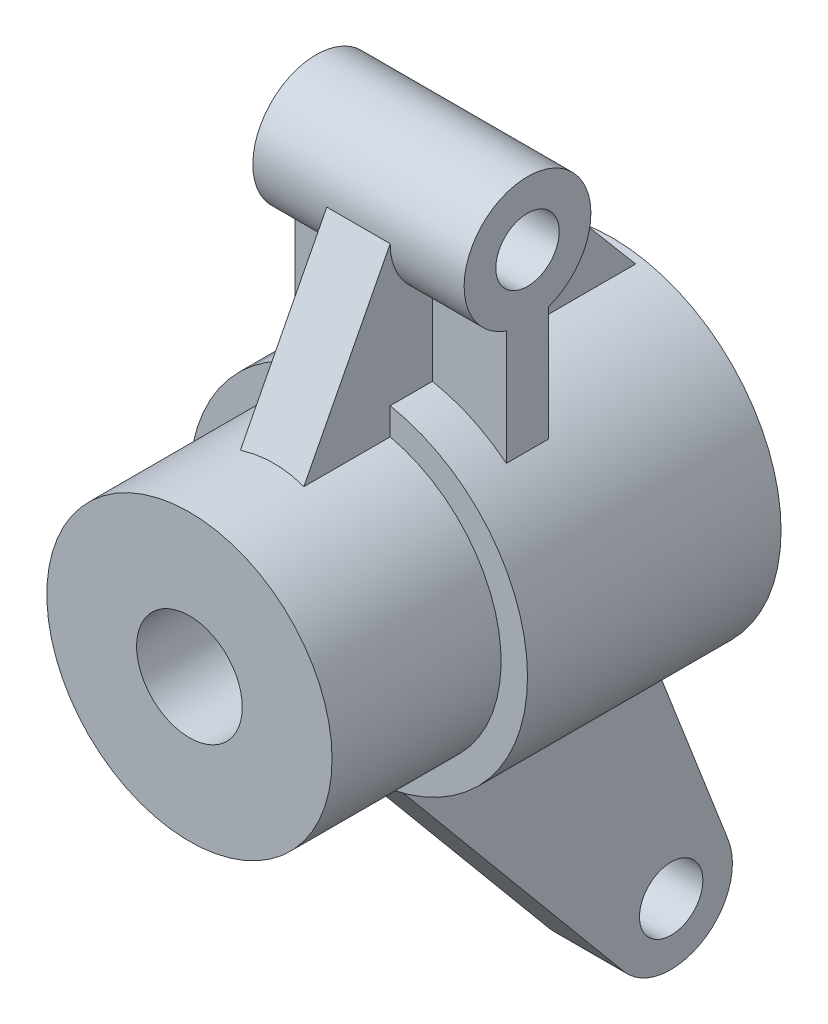
from build123d import *

# Parameters (mm, degrees)
SKETCH1_R                            = 8
BOSS_EXTRUDE1_DEPTH                  = 12
SKETCH2_R                            = 6.75
BOSS_EXTRUDE2_DEPTH                  = 8
SKETCH3_R                            = 2.5
CUT_EXTRUDE1_DEPTH                   = 23.978250586
SKETCH4_R                            = 6.25
CUT_EXTRUDE2_DEPTH                   = 10
SKETCH5_R                            = 4
CUT_EXTRUDE3_DEPTH                   = 13
BOSS_EXTRUDE3_DEPTH                  = 5
BOSS_EXTRUDE3_DEPTH_BACK             = 5
SKETCH6_R                            = 3
SKETCH6_R_2                          = 1.5
BOSS_EXTRUDE4_REACH                  = 31.056
BOSS_EXTRUDE4_END_RADIUS             = 8
SKETCH7_W                            = 10
SKETCH7_H                            = 2
BOSS_EXTRUDE4_DIRECTION_2_REACH      = 31.056
BOSS_EXTRUDE4_DIRECTION_2_END_RADIUS = 3
RIB4_REACH                           = 29.753
SKETCH10_WALL_W                      = 66.021449528
SKETCH10_WALL_H                      = 3
RIB5_REACH                           = 29.753
SKETCH11_WALL_W                      = 66.228138116
SKETCH11_WALL_H                      = 3
BOSS_EXTRUDE5_REACH                  = 48.673
BOSS_EXTRUDE5_END_RADIUS             = 8
RIB7_REACH                           = 32.936
SKETCH15_WALL_W                      = 82.361497922
SKETCH15_WALL_H                      = 3.5
FILLET2_R                            = 2.9
CUT_EXTRUDE5_REACH                   = 33.044
SKETCH19_R                           = 1.5


with BuildPart() as part:
    # Sketch1 → Boss-Extrude1 (new body)
    with BuildSketch(Plane.XY):
        Circle(SKETCH1_R)
    extrude(amount=BOSS_EXTRUDE1_DEPTH)

    # Sketch2 → Boss-Extrude2 (add)
    with BuildSketch(Plane.XY.offset(12)):
        Circle(SKETCH2_R)
    extrude(amount=BOSS_EXTRUDE2_DEPTH)

    # Sketch3 → Cut-Extrude1 (cut, through all)
    with BuildSketch(Plane.XY.offset(20)):
        Circle(SKETCH3_R)
    extrude(amount=-CUT_EXTRUDE1_DEPTH, mode=Mode.SUBTRACT)

    # Sketch4 → Cut-Extrude2 (cut)
    with BuildSketch(Plane(origin=(0, 0, 0), x_dir=(-1, 0, 0), z_dir=(0, 0, -1))):
        Circle(SKETCH4_R)
    extrude(amount=-CUT_EXTRUDE2_DEPTH, mode=Mode.SUBTRACT)

    # Sketch5 → Cut-Extrude3 (cut)
    with BuildSketch(Plane(origin=(0, 0, 0), x_dir=(-1, 0, 0), z_dir=(0, 0, -1))):
        Circle(SKETCH5_R)
    extrude(amount=-CUT_EXTRUDE3_DEPTH, mode=Mode.SUBTRACT)



with BuildPart() as body_2:
    # Sketch6 → Boss-Extrude3 (new, two sides: drawn at the far end of the back side and taken through both)
    with BuildSketch(Plane(origin=(0, 0, 0), x_dir=(0, 0, -1), z_dir=(1, 0, 0)).offset(-BOSS_EXTRUDE3_DEPTH_BACK)):
        with Locations((-9, 14.5)):
            Circle(SKETCH6_R)
        with Locations((-9, 14.5)):
            Circle(SKETCH6_R_2, mode=Mode.SUBTRACT)
    extrude(amount=BOSS_EXTRUDE3_DEPTH + BOSS_EXTRUDE3_DEPTH_BACK)


with BuildPart() as part_1:
    add(part.part)

    add(body_2.part)  # Boss-Extrude4 merges body 2
    # Boss-Extrude4: up to this cylinder (the profile starts outside it)
    boss_extrude4_end = Plane(origin=(0, 0, 9), z_dir=(0, 0, -1)) * Cylinder(BOSS_EXTRUDE4_END_RADIUS, 79.112, mode=Mode.PRIVATE)
    # Sketch7 → Boss-Extrude4 (add, up to the surface)
    with BuildSketch(Plane(origin=(0, 11.5, 0), x_dir=(-1, 0, 0), z_dir=(0, -1, 0)), mode=Mode.PRIVATE) as boss_extrude4_sk1:
        with Locations((0, -9)):
            Rectangle(SKETCH7_W, SKETCH7_H)
    boss_extrude4_tool1 = extrude(boss_extrude4_sk1.sketch, amount=BOSS_EXTRUDE4_REACH, mode=Mode.PRIVATE) - boss_extrude4_end
    add(boss_extrude4_tool1.solids().sort_by_distance((0, 11.5, 9))[0])

    # Boss-Extrude4 direction 2: up to this cylinder (the profile starts outside it)
    boss_extrude4_direction_2_end = Plane(origin=(0, 14.5, 9), z_dir=(1, 0, 0)) * Cylinder(BOSS_EXTRUDE4_DIRECTION_2_END_RADIUS, 69.112, mode=Mode.PRIVATE)
    # Sketch7 → Boss-Extrude4 direction 2 (add, up to the surface)
    with BuildSketch(Plane(origin=(0, 11.5, 0), x_dir=(-1, 0, 0), z_dir=(0, -1, 0)), mode=Mode.PRIVATE) as boss_extrude4_direction_2_sk1:
        with Locations((0, -9)):
            Rectangle(SKETCH7_W, SKETCH7_H)
    boss_extrude4_direction_2_tool1 = extrude(boss_extrude4_direction_2_sk1.sketch, amount=-BOSS_EXTRUDE4_DIRECTION_2_REACH, mode=Mode.PRIVATE) - boss_extrude4_direction_2_end
    add(boss_extrude4_direction_2_tool1.solids().sort_by_distance((0, 11.5, 9))[0])
    add(boss_extrude4_direction_2_tool1.solids().sort_by_distance((0, 11.5, 9))[1])

    # Sketch10 wall → Rib4 (add, up to next)
    with BuildSketch(Plane(origin=(0, 11.25, 3.25), x_dir=(0, -0.763386285369, -0.645942241466), z_dir=(0, 0.645942241466, -0.763386285369)), mode=Mode.PRIVATE) as rib4_sk1:
        Rectangle(SKETCH10_WALL_W, SKETCH10_WALL_H)
    rib4_tool1 = extrude(rib4_sk1.sketch, amount=-RIB4_REACH, mode=Mode.PRIVATE) - part_1.part
    add(rib4_tool1.solids().sort_by_distance((0, 11.25, 3.25))[0])

    # Sketch11 wall → Rib5 (add, up to next)
    with BuildSketch(Plane(origin=(0, 10.625, 14), x_dir=(0, 0.888620657055, -0.45864291977), z_dir=(0, 0.45864291977, 0.888620657055)), mode=Mode.PRIVATE) as rib5_sk1:
        Rectangle(SKETCH11_WALL_W, SKETCH11_WALL_H)
    rib5_tool1 = extrude(rib5_sk1.sketch, amount=-RIB5_REACH, mode=Mode.PRIVATE) - part_1.part
    add(rib5_tool1.solids().sort_by_distance((0, 10.625, 14))[0])

    # Boss-Extrude5: up to this cylinder (the profile starts outside it)
    boss_extrude5_end = Plane(origin=(0, 0, -2.46858), z_dir=(0, 0, -1)) * Cylinder(BOSS_EXTRUDE5_END_RADIUS, 114.346, mode=Mode.PRIVATE)
    # Sketch13 → Boss-Extrude5 (add, up to the surface)
    with BuildSketch(Plane(origin=(0, -19.357466063, -7.49321267), x_dir=(0, -0.3609941025577127, 0.9325680982740894), z_dir=(0, 0.9325680982740895, 0.36099410255771275)), mode=Mode.PRIVATE) as boss_extrude5_sk1:
        Polygon((2.88795282, 0), (2.88795282, 1.75), (7.88795282, 1.75), (7.88795282, 0), (7.88795282, -1.75), (2.88795282, -1.75), align=None)
    boss_extrude5_tool1 = extrude(boss_extrude5_sk1.sketch, amount=BOSS_EXTRUDE5_REACH, mode=Mode.PRIVATE) - boss_extrude5_end
    add(boss_extrude5_tool1.solids().sort_by_distance((0, -21.302485, -2.46858))[0])

    # Sketch15 wall → Rib7 (add, up to next)
    with BuildSketch(Plane(origin=(0, -15.102485256, 5.779996022), x_dir=(0, 0.768305445704, 0.640083386835), z_dir=(0, -0.640083386835, 0.768305445704)), mode=Mode.PRIVATE) as rib7_sk1:
        Rectangle(SKETCH15_WALL_W, SKETCH15_WALL_H)
    rib7_tool1 = extrude(rib7_sk1.sketch, amount=-RIB7_REACH, mode=Mode.PRIVATE) - part_1.part
    add(rib7_tool1.solids().sort_by_distance((0, -15.102485256, 5.779996022))[0])

    # Fillet2
    fillet2_edges = [part_1.edges().sort_by_distance(p)[0] for p in [
        (0, -20.4, -4.8),
        (0, -22.204970513, -0.137159509),
    ]]
    fillet(fillet2_edges, radius=FILLET2_R)

    # Sketch19 → Cut-Extrude5 (cut, up to next)
    with BuildSketch(Plane(origin=(1.75, 0, 0), x_dir=(0, 0, -1), z_dir=(1, 0, 0)), mode=Mode.PRIVATE) as cut_extrude5_sk1:
        with Locations((1.048669618, -18.742435412)):
            Circle(SKETCH19_R)
    cut_extrude5_tool1 = extrude(cut_extrude5_sk1.sketch, amount=-CUT_EXTRUDE5_REACH, mode=Mode.PRIVATE) & part_1.part
    add(cut_extrude5_tool1.solids().sort_by_distance((1.75, -18.742435, -1.04867))[0], mode=Mode.SUBTRACT)


solid = part_1.part
